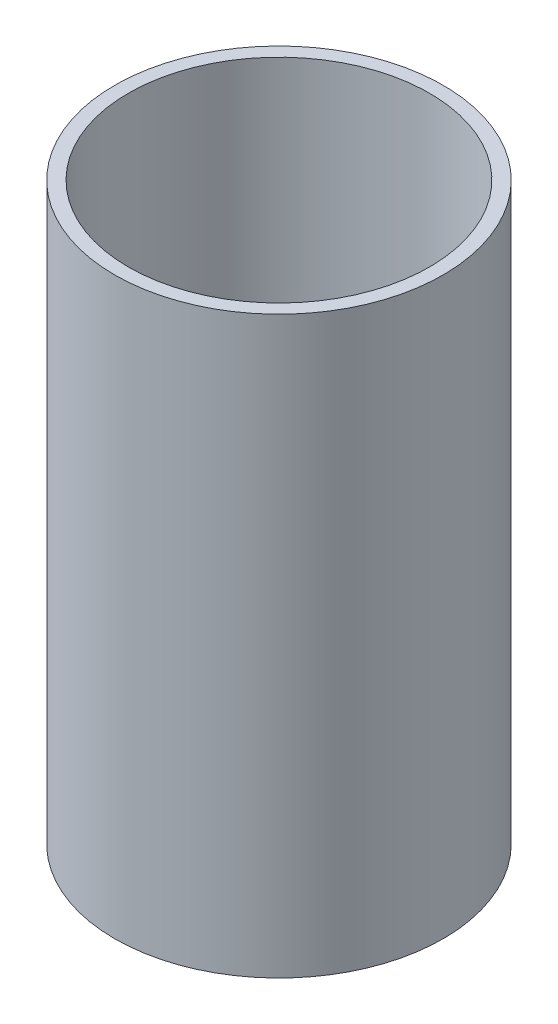
from build123d import *

# Parameters (mm, degrees)
SKETCH1_R           = 12
SKETCH1_R_2         = 11
BOSS_EXTRUDE1_DEPTH = 42


with BuildPart() as part:
    # Sketch1 → Boss-Extrude1 (new body)
    with BuildSketch(Plane(origin=(0, 0, 0), x_dir=(1, 0, 0), z_dir=(0, 1, 0))):
        with Locations(Location((0, 0, 0), (0, 0, 270))):
            Circle(SKETCH1_R)
        with Locations(Location((0, 0, 0), (0, 0, 270))):
            Circle(SKETCH1_R_2, mode=Mode.SUBTRACT)
    extrude(amount=-BOSS_EXTRUDE1_DEPTH)


solid = part.part
